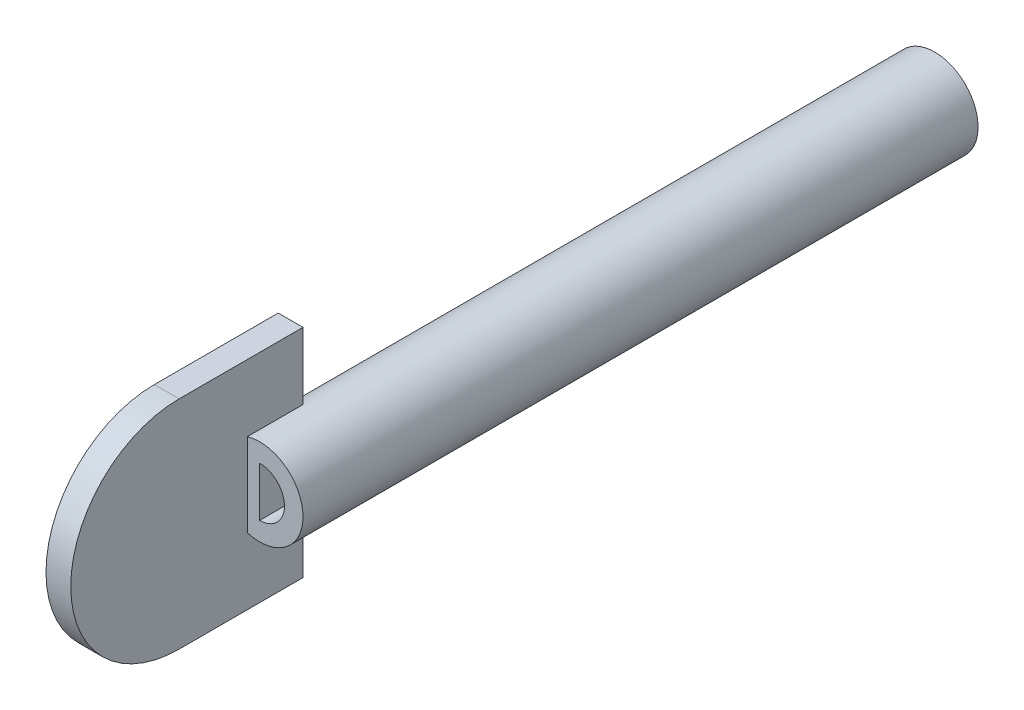
from build123d import *

# Parameters (mm, degrees)
ESQUISSE1_W             = 40
ESQUISSE1_H             = 35
BOSS_EXTRU_1_DEPTH      = 4
ESQUISSE2_R             = 10
ENL_V_MAT_EXTRU_1_DEPTH = 2
ENL_V_MAT_EXTRU_2_DEPTH = 27.874709301
BOSS_EXTRU_2_DEPTH      = 100
BOSS_EXTRU_2_DEPTH_BACK = 9
ESQUISSE4_R             = 7
ESQUISSE5_R             = 6
ENL_V_MAT_EXTRU_5_DEPTH = 99
ENL_V_MAT_EXTRU_9_DEPTH = 99


with BuildPart() as part:
    # Esquisse1 → Boss.-Extru.1 (new body)
    with BuildSketch(Plane(origin=(0, 0, 0), x_dir=(0, 0, -1), z_dir=(1, 0, 0))):
        Rectangle(ESQUISSE1_W, ESQUISSE1_H)
    extrude(amount=BOSS_EXTRU_1_DEPTH)

    # Esquisse2 → Enlèv. mat.-Extru.1 (cut)
    with BuildSketch(Plane.ZY):
        Circle(ESQUISSE2_R)
    extrude(amount=-ENL_V_MAT_EXTRU_1_DEPTH, mode=Mode.SUBTRACT)

    # Esquisse3 → Enlèv. mat.-Extru.2 (cut, through all)
    with BuildSketch(Plane.ZY):
        with BuildLine():
            Line((0, -17.5), (20, -17.5))
            Line((20, -17.5), (20, 17.5))
            Line((20, 17.5), (0, 17.5))
            ThreePointArc((0, 17.5), (17.5, 0), (0, -17.5))
        make_face()
    extrude(amount=-ENL_V_MAT_EXTRU_2_DEPTH, mode=Mode.SUBTRACT)

    # Esquisse4 → Boss.-Extru.2 (add, two sides: drawn at the far end of the back side and taken through both)
    with BuildSketch(Plane(origin=(0, 0, -20), x_dir=(-1, 0, 0), z_dir=(0, 0, -1)).offset(-BOSS_EXTRU_2_DEPTH_BACK)):
        with Locations((-6, 0)):
            Circle(ESQUISSE4_R)
    extrude(amount=BOSS_EXTRU_2_DEPTH + BOSS_EXTRU_2_DEPTH_BACK)

    # Esquisse5 → Enlèv. mat.-Extru.5 (cut)
    with BuildSketch(Plane(origin=(0, 0, -120), x_dir=(-1, 0, 0), z_dir=(0, 0, -1))):
        with Locations((-6, 0)):
            Circle(ESQUISSE5_R)
    extrude(amount=-ENL_V_MAT_EXTRU_5_DEPTH, mode=Mode.SUBTRACT)

    # Esquisse10 → Enlèv. mat.-Extru.9 (cut)
    with BuildSketch(Plane.XY.offset(-11)):
        with BuildLine():
            Line((6, -4), (6, 4))
            ThreePointArc((6, 4), (10, 0), (6, -4))
        make_face()
    extrude(amount=-ENL_V_MAT_EXTRU_9_DEPTH, mode=Mode.SUBTRACT)


solid = part.part
